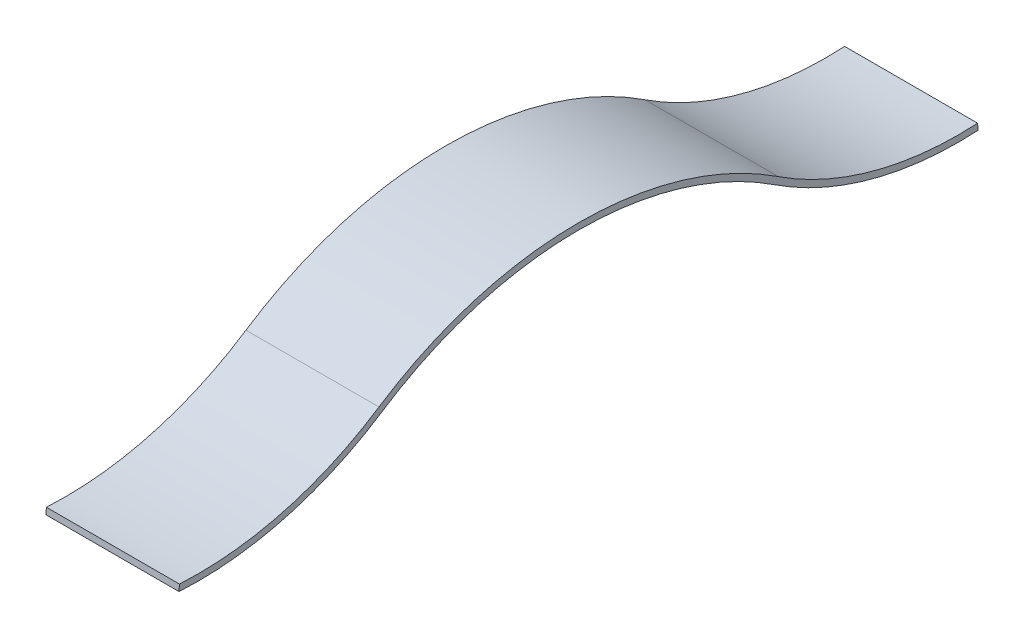
from build123d import *

# Parameters (mm, degrees)
EXTRUDE_THIN1_DEPTH = 3.175


with BuildPart() as part:
    # Sketch1 → Extrude-Thin1 (new, symmetric)
    with BuildSketch(Plane(origin=(0, 0, 0), x_dir=(0, 0, -1), z_dir=(1, 0, 0))):
        with BuildLine():
            ThreePointArc((-19.05, 0.3048), (-14.081230666, 0.814453346), (-9.525000281, 2.861201965))
            ThreePointArc((-9.525000281, 2.861201965), (0, 5.715), (9.525000281, 2.861201965))
            ThreePointArc((9.525000281, 2.861201965), (14.081230666, 0.814453346), (19.05, 0.3048))
            Line((19.05, 0.3048), (19.067602036, 0.000508679))
            ThreePointArc((19.067602036, 0.000508679), (14.002221921, 0.520071522), (9.357401999, 2.606616309))
            ThreePointArc((9.357401999, 2.606616309), (0, 5.4102), (-9.357401999, 2.606616309))
            ThreePointArc((-9.357401999, 2.606616309), (-14.002221921, 0.520071522), (-19.067602036, 0.000508679))
            Line((-19.067602036, 0.000508679), (-19.05, 0.3048))
        make_face()
    extrude(amount=EXTRUDE_THIN1_DEPTH, both=True)


solid = part.part
